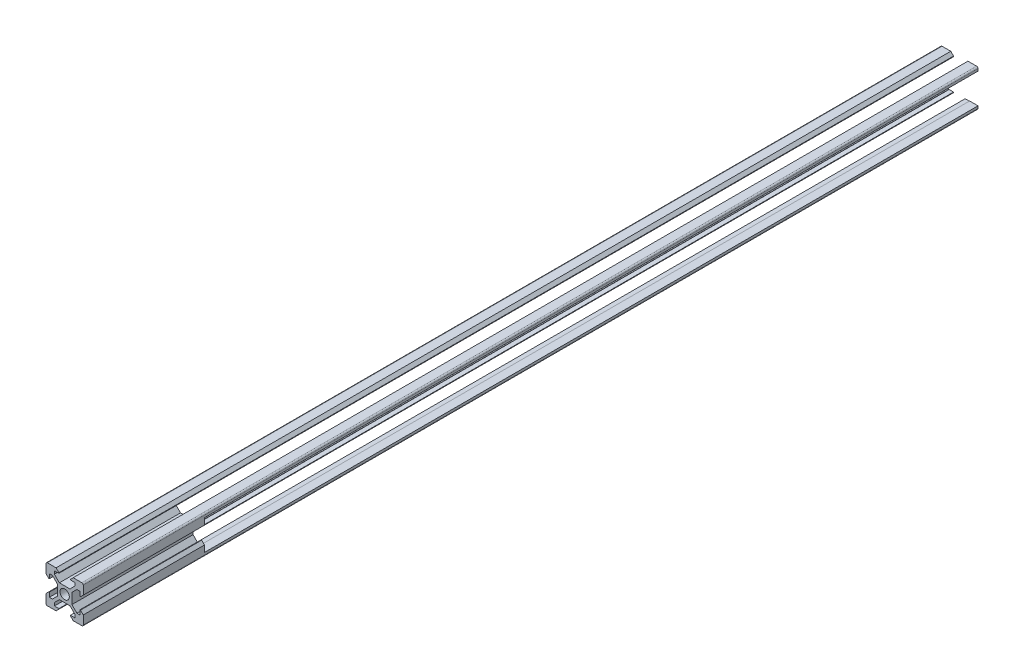
from build123d import *

# Parameters (mm, degrees)
CROQUIS1_R              = 2.5
SALIENTE_EXTRUIR1_DEPTH = 480
CUT_EXTRUDE1_DEPTH      = 47
CUT_EXTRUDE1_DEPTH_BACK = 46
SKETCH2_W               = 830
SKETCH2_H               = 16.121490986


with BuildPart() as part:
    # Croquis1 → Saliente-Extruir1 (new body)
    with BuildSketch(Plane.XY):
        with BuildLine():
            Line((-4.6, 10), (-3.1, 8.5))
            Line((-3.1, 8.5), (-3.1, 8.2))
            Line((-3.1, 8.2), (-5.5, 8.2))
            Line((-5.5, 8.2), (-5.5, 6.560660172))
            Line((-5.5, 6.560660172), (-2.84, 3.900660172))
            Line((-2.84, 3.900660172), (0, 3.900660172))
            Line((0, 3.900660172), (2.84, 3.900660172))
            Line((2.84, 3.900660172), (5.5, 6.560660172))
            Line((5.5, 6.560660172), (5.5, 8.2))
            Line((5.5, 8.2), (3.1, 8.2))
            Line((3.1, 8.2), (3.1, 8.5))
            Line((3.1, 8.5), (4.6, 10))
            Line((4.6, 10), (9.25, 10))
            ThreePointArc((9.25, 10), (9.780330086, 9.780330086), (10, 9.25))
            Line((10, 9.25), (10, 4.6))
            Line((10, 4.6), (8.5, 3.1))
            Line((8.5, 3.1), (8.2, 3.1))
            Line((8.2, 3.1), (8.2, 5.5))
            Line((8.2, 5.5), (6.560660172, 5.5))
            Line((6.560660172, 5.5), (3.900660172, 2.84))
            Line((3.900660172, 2.84), (3.900660172, 0))
            Line((3.900660172, 0), (3.900660172, -2.84))
            Line((3.900660172, -2.84), (6.560660172, -5.5))
            Line((6.560660172, -5.5), (8.2, -5.5))
            Line((8.2, -5.5), (8.2, -3.1))
            Line((8.2, -3.1), (8.5, -3.1))
            Line((8.5, -3.1), (10, -4.6))
            Line((10, -4.6), (10, -9.25))
            ThreePointArc((10, -9.25), (9.780330086, -9.780330086), (9.25, -10))
            Line((9.25, -10), (4.6, -10))
            Line((4.6, -10), (3.1, -8.5))
            Line((3.1, -8.5), (3.1, -8.2))
            Line((3.1, -8.2), (5.5, -8.2))
            Line((5.5, -8.2), (5.5, -6.560660172))
            Line((5.5, -6.560660172), (2.84, -3.900660172))
            Line((2.84, -3.900660172), (0, -3.900660172))
            Line((0, -3.900660172), (-2.84, -3.900660172))
            Line((-2.84, -3.900660172), (-5.5, -6.560660172))
            Line((-5.5, -6.560660172), (-5.5, -8.2))
            Line((-5.5, -8.2), (-3.1, -8.2))
            Line((-3.1, -8.2), (-3.1, -8.5))
            Line((-3.1, -8.5), (-4.6, -10))
            Line((-4.6, -10), (-9.25, -10))
            ThreePointArc((-9.25, -10), (-9.780330086, -9.780330086), (-10, -9.25))
            Line((-10, -9.25), (-10, -4.6))
            Line((-10, -4.6), (-8.5, -3.1))
            Line((-8.5, -3.1), (-8.2, -3.1))
            Line((-8.2, -3.1), (-8.2, -5.5))
            Line((-8.2, -5.5), (-6.560660172, -5.5))
            Line((-6.560660172, -5.5), (-3.900660172, -2.84))
            Line((-3.900660172, -2.84), (-3.900660172, 0))
            Line((-3.900660172, 0), (-3.900660172, 2.84))
            Line((-3.900660172, 2.84), (-6.560660172, 5.5))
            Line((-6.560660172, 5.5), (-8.2, 5.5))
            Line((-8.2, 5.5), (-8.2, 3.1))
            Line((-8.2, 3.1), (-8.5, 3.1))
            Line((-8.5, 3.1), (-10, 4.6))
            Line((-10, 4.6), (-10, 9.25))
            ThreePointArc((-10, 9.25), (-9.780330086, 9.780330086), (-9.25, 10))
            Line((-9.25, 10), (-4.6, 10))
        make_face()
        Circle(CROQUIS1_R, mode=Mode.SUBTRACT)
    extrude(amount=SALIENTE_EXTRUIR1_DEPTH)

    # Sketch2 → Cut-Extrude1 (cut, two sides: drawn at the far end of the back side and taken through both)
    with BuildSketch(Plane(origin=(0, 0, 0), x_dir=(0, 0, -1), z_dir=(1, 0, 0)).offset(-CUT_EXTRUDE1_DEPTH_BACK)):
        Rectangle(SKETCH2_W, SKETCH2_H)
    extrude(amount=CUT_EXTRUDE1_DEPTH + CUT_EXTRUDE1_DEPTH_BACK, mode=Mode.SUBTRACT)


solid = part.part
